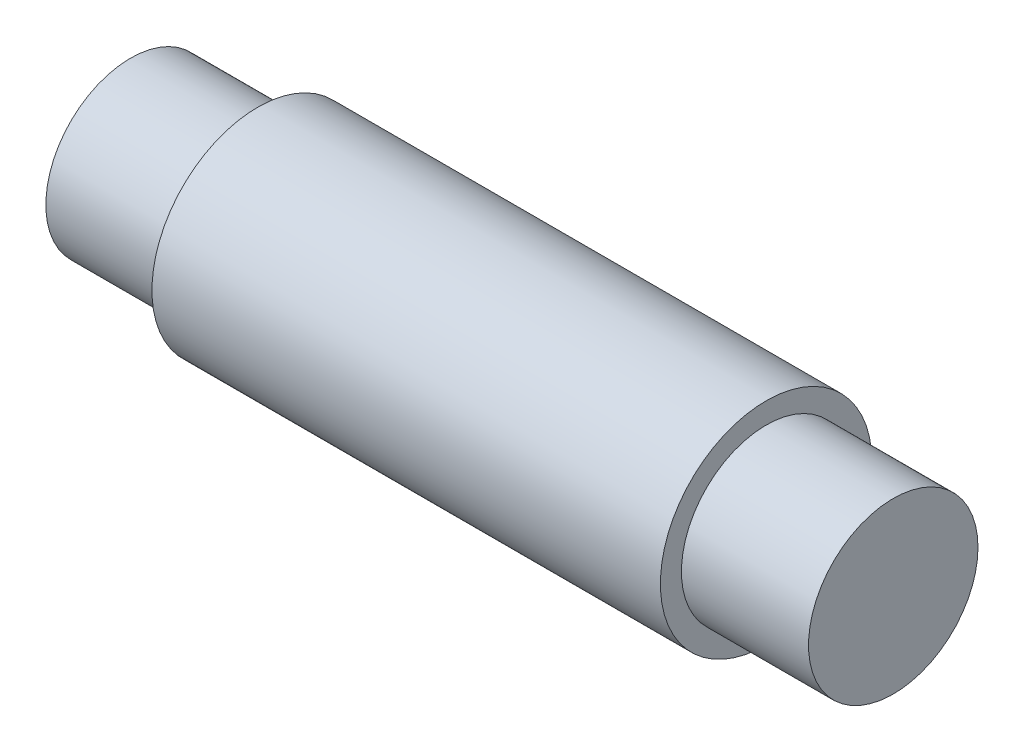
from build123d import *

# Parameters (mm, degrees)
SKETCH1_W = 4.7625
SKETCH1_H = 3.175


with BuildPart() as part:
    # Sketch1 → Revolve1 (revolve)
    with BuildSketch(Plane.XY, mode=Mode.PRIVATE) as revolve1_sk:
        with Locations((-11.90625, 1.5875)):
            Rectangle(SKETCH1_W, SKETCH1_H)
        Polygon((-9.525, 0), (0, 0), (0, 3.9624), (-9.525, 3.9624), (-9.525, 3.175), align=None)
        Polygon((0, 3.9624), (0, 0), (9.525, 0), (9.525, 3.175), (9.525, 3.9624), align=None)
        with Locations((11.90625, 1.5875)):
            Rectangle(SKETCH1_W, SKETCH1_H)
    revolve(revolve1_sk.sketch.rotate(Axis((9.525, 0, 0), (-1, 0, 0)), 90), axis=Axis((9.525, 0, 0), (-1, 0, 0)))


solid = part.part
